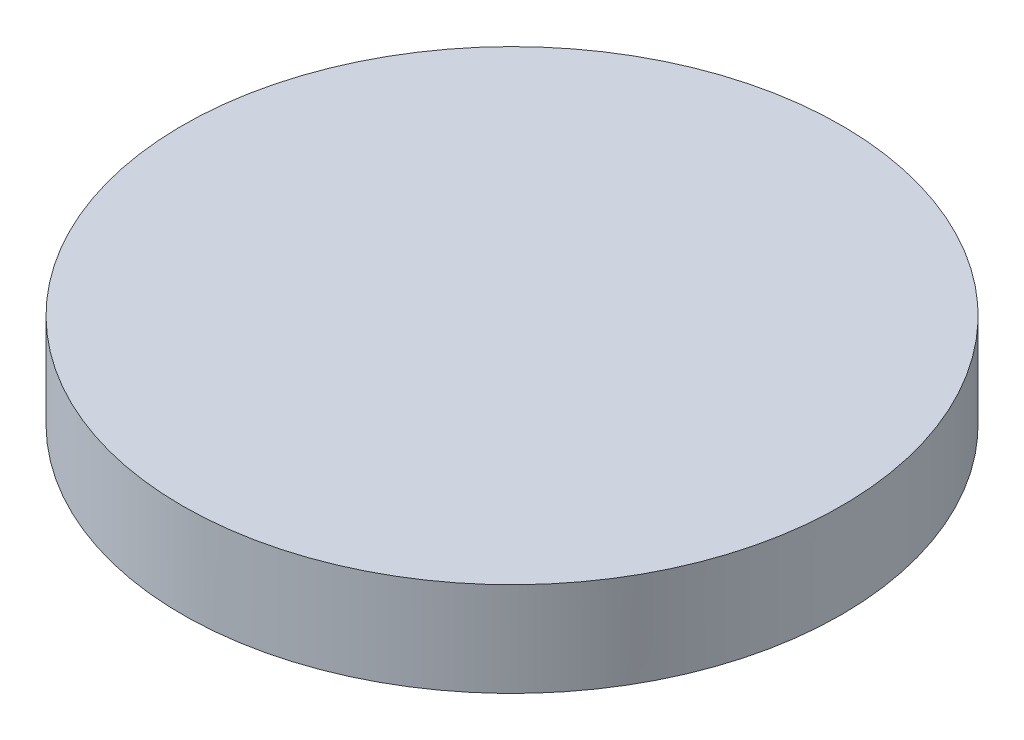
from build123d import *

# Parameters (mm, degrees)
BASE_R                    = 28
EXTRUSAO_BASE_DEPTH       = 8
CORTE_BASE_R              = 26.5
EXTRUSAO_CORTE_BASE_DEPTH = 5
USB_W                     = 142.526664036
USB_H                     = 10.2
CORTE_USB_DEPTH           = 5
EXTRUSAO_SUPORTE_START    = 5
SUPORTE_R                 = 0.75
EXTRUSAO_SUPORTE_DEPTH    = 2


with BuildPart() as part:
    # base → extrusao_base (new body)
    with BuildSketch(Plane(origin=(0, 0, 0), x_dir=(1, 0, 0), z_dir=(0, 1, 0))):
        with Locations(Location((0, 0, 0), (0, 0, 270))):
            Circle(BASE_R)
    extrude(amount=EXTRUSAO_BASE_DEPTH)

    # corte_base → extrusao_corte_base (cut)
    with BuildSketch(Plane(origin=(0, 0, 0), x_dir=(1, 0, 0), z_dir=(0, 1, 0))):
        with Locations(Location((0, 0, 0), (0, 0, 270))):
            Circle(CORTE_BASE_R)
    extrude(amount=EXTRUSAO_CORTE_BASE_DEPTH, mode=Mode.SUBTRACT)

    # usb → corte_usb (cut)
    with BuildSketch(Plane(origin=(0, 0, 0), x_dir=(1, 0, 0), z_dir=(0, 1, 0))):
        with Locations((-71.263332018, 0)):
            Rectangle(USB_W, USB_H)
    extrude(amount=CORTE_USB_DEPTH, mode=Mode.SUBTRACT)


with BuildPart() as body_2:
    # suporte → extrusao_suporte (new body)
    with BuildSketch(Plane(origin=(0, 0, 0), x_dir=(1, 0, 0), z_dir=(0, 1, 0)).offset(EXTRUSAO_SUPORTE_START)):
        with Locations(Location((-11.22, -13.02, 0), (0, 0, 270))):
            Circle(SUPORTE_R)
    extrude(amount=-EXTRUSAO_SUPORTE_DEPTH)


solid = Compound([part.part, body_2.part])
